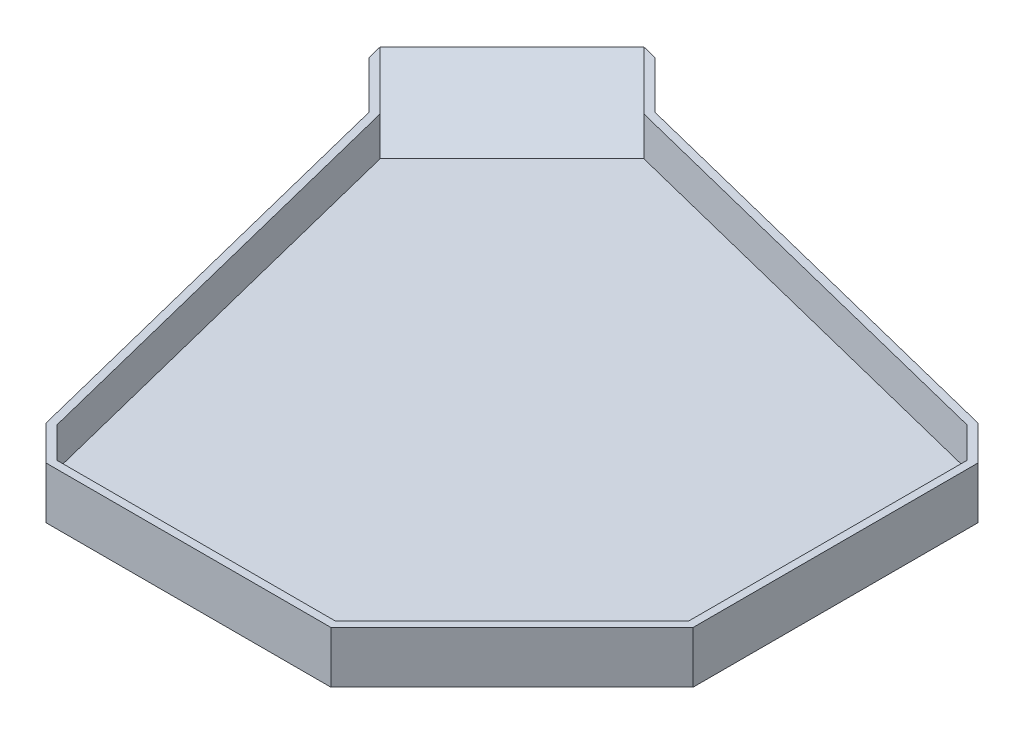
from build123d import *

# Parameters (mm, degrees)
EXTRUDE_1_DEPTH     = 5
EXTRUDE_2_DEPTH     = 15
CUT_EXTRUDE_1_DEPTH = 60
SKETCH_4_R          = 4
CUT_EXTRUDE_2_DEPTH = 60
EXTRUDE_3_DEPTH     = 15
SKETCH_6_W          = 72.003415158
SKETCH_6_H          = 5
EXTRUDE_4_DEPTH     = 13
EXTRUDE_5_DEPTH     = 20
EXTRUDE_6_DEPTH     = 72


with BuildPart() as part:
    # 草图1 → 凸台-拉伸1 (new body)
    with BuildSketch(Plane(origin=(0, 0, 0), x_dir=(1, 0, 0), z_dir=(0, 1, 0))):
        Polygon((-50, 10), (-10, 50), (176.666666667, 3.333333333), (190, -10), (190, -120), (120, -190), (10, -190), (-3.333333333, -176.666666667), align=None)
    extrude(amount=EXTRUDE_1_DEPTH)

    # 草图2 → 凸台-拉伸2 (add)
    with BuildSketch(Plane.XZ):
        Polygon((-50, -10), (-39.393398282, 0.606601718), (0.606601718, -39.393398282), (-10, -50), align=None)
    extrude(amount=EXTRUDE_2_DEPTH)

    # 草图3 → 切除-拉伸1 (cut)
    with BuildSketch(Plane(origin=(20, 0, -20), x_dir=(-0.7071067811865475, 0, -0.7071067811865476), z_dir=(0.7071067811865476, 0, -0.7071067811865475))):
        with BuildLine():
            Line((27.426406871, -7.5), (27.426406871, -15))
            Line((27.426406871, -15), (34.926406871, -15))
            ThreePointArc((34.926406871, -15), (29.623106012, -12.803300859), (27.426406871, -7.5))
        make_face()
    extrude(amount=-CUT_EXTRUDE_1_DEPTH, mode=Mode.SUBTRACT)

    # 草图4 → 切除-拉伸2 (cut)
    with BuildSketch(Plane(origin=(20, 0, -20), x_dir=(-0.7071067811865474, 0, -0.7071067811865477), z_dir=(0.7071067811865477, 0, -0.7071067811865474))):
        with Locations((34.926406871, -7.5)):
            Circle(SKETCH_4_R)
        with BuildLine():
            Line((34.926406871, -15), (42.426406871, -15))
            Line((42.426406871, -15), (42.426406871, -7.5))
            ThreePointArc((42.426406871, -7.5), (40.22970773, -12.803300859), (34.926406871, -15))
        make_face()
    extrude(amount=-CUT_EXTRUDE_2_DEPTH, mode=Mode.SUBTRACT)

    # 草图5 → 凸台-拉伸3 (add)
    with BuildSketch(Plane(origin=(0, 5, 0), x_dir=(1, 0, 0), z_dir=(0, 1, 0))):
        Polygon((-0.62444127, -175.132918043), (11.242640687, -187), (118.757359313, -187), (187, -118.757359313), (187, -11.242640687), (175.132918043, 0.62444127), (8.675243128, 42.238859999), (4.552137502, 46.361965624), (176.666666667, 3.333333333), (190, -10), (190, -120), (120, -190), (10, -190), (-3.333333333, -176.666666667), (-46.361965624, -4.552137502), (-42.238859999, -8.675243128), align=None)
    extrude(amount=EXTRUDE_3_DEPTH)

    # 草图6 → 凸台-拉伸4 (add, symmetric)
    with BuildSketch(Plane(origin=(-30, 0, -30), x_dir=(-0.7071067811865475, 0, 0.7071067811865476), z_dir=(-0.7071067811865476, 0, -0.7071067811865475))):
        with Locations((0, 2.5)):
            Rectangle(SKETCH_6_W, SKETCH_6_H)
    extrude(amount=EXTRUDE_4_DEPTH, both=True)

    # 草图7 → 凸台-拉伸5 (add)
    with BuildSketch(Plane(origin=(0, 20, 0), x_dir=(1, 0, 0), z_dir=(0, 1, 0))):
        Polygon((-42.238859999, -8.675243128), (-64.649439719, 13.735336592), (-63.235226156, 8.078482343), (-44.947752062, -10.208991752), align=None)
        Polygon((8.675243128, 42.238859999), (-13.735336592, 64.649439719), (-8.078482343, 63.235226156), (10.208991752, 44.947752062), align=None)
    extrude(amount=-EXTRUDE_5_DEPTH)

    # 草图8 → 凸台-拉伸6 (add)
    with BuildSketch(Plane(origin=(25.457051563, 0, -25.457051563), x_dir=(0.7071067811865439, 0, 0.7071067811865511), z_dir=(-0.7071067811865511, 0, 0.7071067811865439))):
        Polygon((-55.426406871, 20), (-23.733061091, 5), (-55.426406871, 5), align=None)
    extrude(amount=EXTRUDE_6_DEPTH)


solid = part.part
